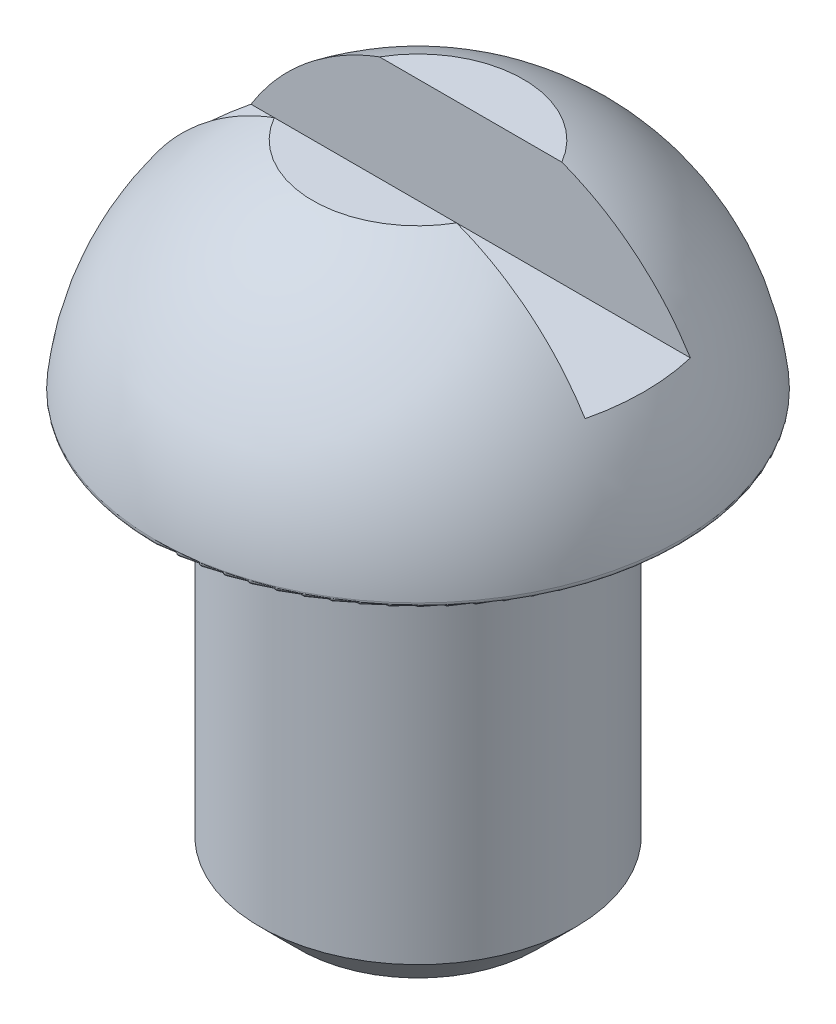
from build123d import *

# Parameters (mm, degrees)
FILLET_1_R          = 0.1
SKETCH_3_W          = 10
SKETCH_3_H          = 2
CUT_EXTRUDE_2_DEPTH = 2


with BuildPart() as part:
    # Эскиз1 → Повернуть1 (revolve)
    with BuildSketch(Plane.XY):
        with BuildLine():
            Line((5, 8), (3, 8))
            Line((3, 8), (3, 0.75))
            Line((3, 0.75), (2.25, 0))
            Line((2.25, 0), (0, 0))
            Line((0, 0), (0, 12.2))
            Line((0, 12.2), (2, 12.2))
            ThreePointArc((2, 12.2), (4.083835358, 10.517025256), (5, 8))
        make_face()
    revolve(axis=Axis((0, 0, 0), (0, 1, 0)))

    # Скругление1
    fillet_1_edges = [part.edges().sort_by_distance(p)[0] for p in [
        (-5, 8, 0),
    ]]
    fillet(fillet_1_edges, radius=FILLET_1_R)

    # Эскиз3 → Вырез-Вытянуть2 (cut)
    with BuildSketch(Plane(origin=(0, 12.2, 0), x_dir=(-1, 0, 0), z_dir=(0, 1, 0))):
        Rectangle(SKETCH_3_W, SKETCH_3_H)
    extrude(amount=-CUT_EXTRUDE_2_DEPTH, mode=Mode.SUBTRACT)


solid = part.part
